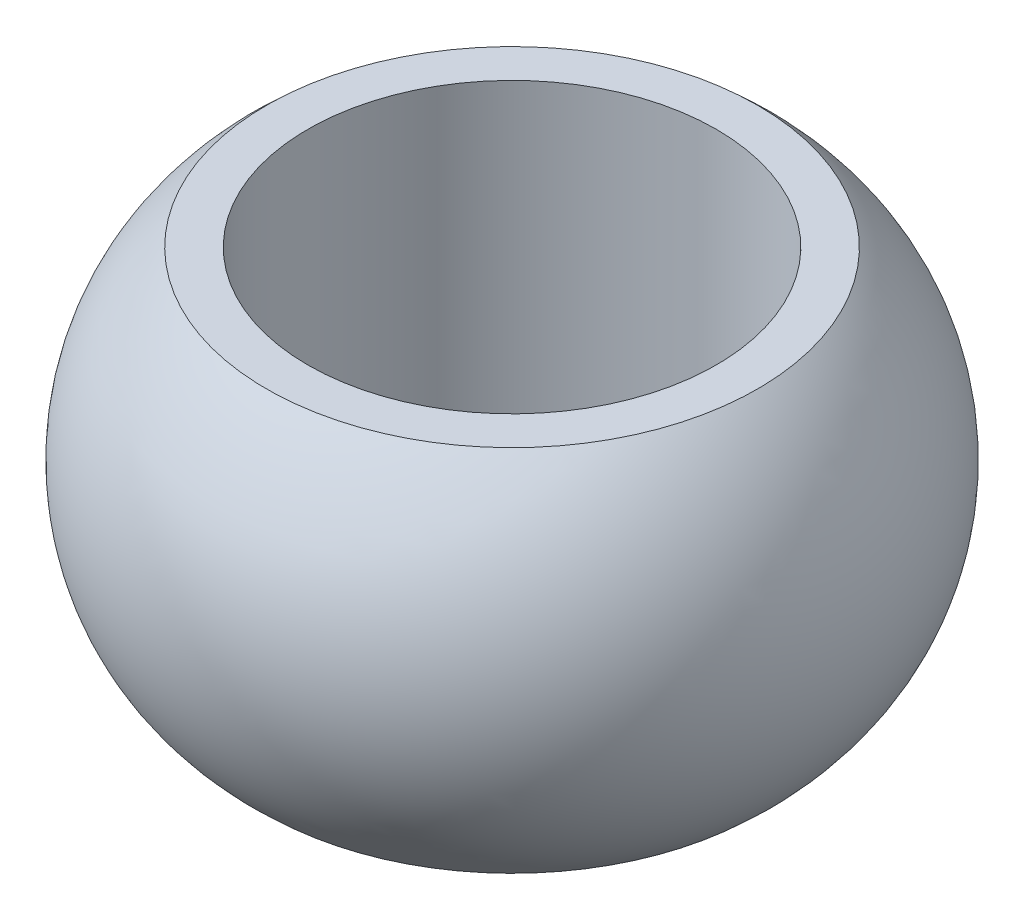
from build123d import *


with BuildPart() as part:
    # Sketch1 → Revolve1 (revolve)
    with BuildSketch(Plane.XY, mode=Mode.PRIVATE) as revolve1_sk:
        with BuildLine():
            Line((4.93, -4.45), (4.93, 4.45))
            Line((4.93, 4.45), (5.93, 4.45))
            ThreePointArc((5.93, 4.45), (7.96, 0), (5.93, -4.45))
            Line((5.93, -4.45), (4.93, -4.45))
        make_face()
    revolve(revolve1_sk.sketch.rotate(Axis((0, 0, 0), (0, 1, 0)), 90), axis=Axis((0, 0, 0), (0, 1, 0)))


solid = part.part
